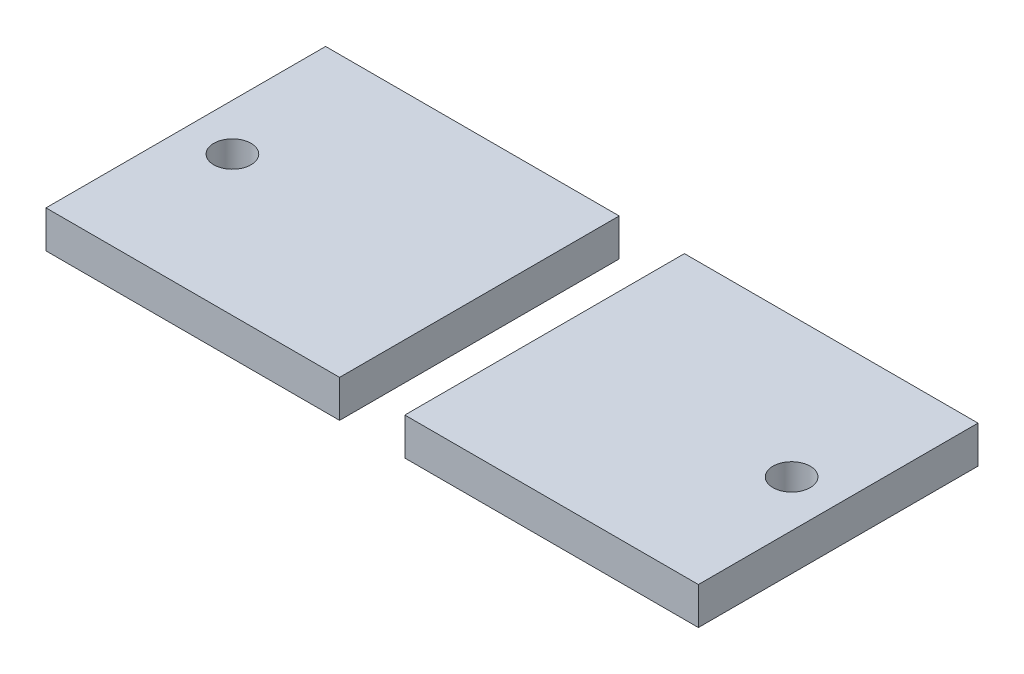
from build123d import *

# Parameters (mm, degrees)
SKETCH1_W             = 31.5
SKETCH1_H             = 30
BOSS_EXTRUDE1_DEPTH   = 4
BOSS_EXTRUDE1_2_DEPTH = 4
SKETCH2_R             = 2
CUT_EXTRUDE1_DEPTH    = 4


with BuildPart() as part:
    # Sketch1 → Boss-Extrude1 (new body)
    with BuildSketch(Plane(origin=(0, 0, 0), x_dir=(1, 0, 0), z_dir=(0, 1, 0))):
        with Locations((-19.25, 0)):
            Rectangle(SKETCH1_W, SKETCH1_H)
    extrude(amount=BOSS_EXTRUDE1_DEPTH)


with BuildPart() as body_2:
    # Sketch1 → Boss-Extrude1 2 (new body)
    with BuildSketch(Plane(origin=(0, 0, 0), x_dir=(1, 0, 0), z_dir=(0, 1, 0))):
        with Locations((19.25, 0)):
            Rectangle(SKETCH1_W, SKETCH1_H)
    extrude(amount=BOSS_EXTRUDE1_2_DEPTH)


with BuildPart() as cut_extrude1_tool:
    # Sketch2 → Cut-Extrude1 (new body)
    with BuildSketch(Plane(origin=(0, 4, 0), x_dir=(1, 0, 0), z_dir=(0, 1, 0))):
        with Locations((-30, 0)):
            Circle(SKETCH2_R)
        with Locations((30, 0)):
            Circle(SKETCH2_R)
    extrude(amount=-CUT_EXTRUDE1_DEPTH)


with BuildPart() as part_1:
    add(part.part)

    # Cut-Extrude1: cut by cut_extrude1_tool
    add(cut_extrude1_tool.part, mode=Mode.SUBTRACT)


with BuildPart() as body_2_1:
    add(body_2.part)

    # Cut-Extrude1: cut by cut_extrude1_tool
    add(cut_extrude1_tool.part, mode=Mode.SUBTRACT)


solid = Compound([part_1.part, body_2_1.part])
